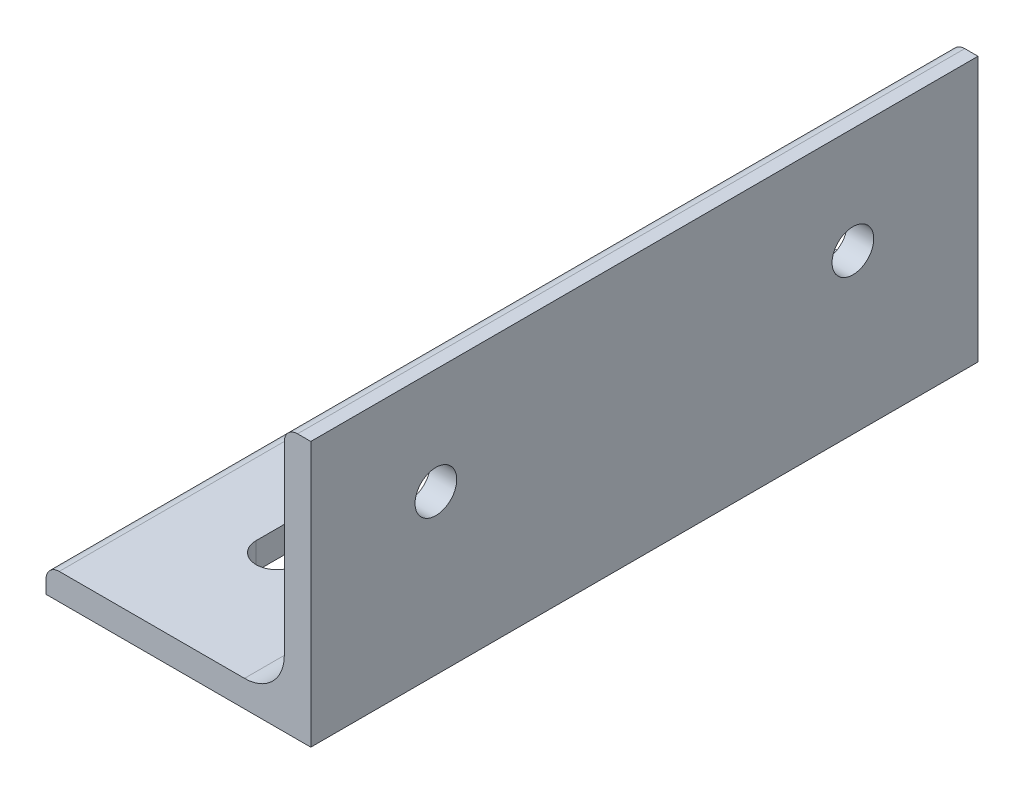
from build123d import *

# Parameters (mm, degrees)
BOSS_EXTRUDE1_DEPTH = 304.8
SKETCH3_W           = 34.414454966
SKETCH3_H           = 33.657940314
CUT_EXTRUDE1_DEPTH  = 529.6
SKETCH5_R           = 2.5
CUT_EXTRUDE2_DEPTH  = 101.6
CUT_EXTRUDE3_DEPTH  = 101.6


with BuildPart() as part:
    # Sketch2 → Boss-Extrude1 (new, symmetric)
    with BuildSketch(Plane.XY):
        with BuildLine():
            Line((-15.875, -15.875), (15.875, -15.875))
            Line((15.875, -15.875), (15.875, 15.875))
            Line((15.875, 15.875), (14.2875, 15.875))
            ThreePointArc((14.2875, 15.875), (13.164967985, 15.410032015), (12.7, 14.2875))
            Line((12.7, 14.2875), (12.7, -7.9248))
            ThreePointArc((12.7, -7.9248), (11.301376302, -11.301376302), (7.9248, -12.7))
            Line((7.9248, -12.7), (-14.2875, -12.7))
            ThreePointArc((-14.2875, -12.7), (-15.410032015, -13.164967985), (-15.875, -14.2875))
            Line((-15.875, -14.2875), (-15.875, -15.875))
        make_face()
    extrude(amount=BOSS_EXTRUDE1_DEPTH, both=True)

    # Sketch3 → Cut-Extrude1 (cut)
    with BuildSketch(Plane(origin=(0, 0, -304.8), x_dir=(-1, 0, 0), z_dir=(0, 0, -1))):
        with Locations((1.332227483, 0.953970157)):
            Rectangle(SKETCH3_W, SKETCH3_H)
    extrude(amount=-CUT_EXTRUDE1_DEPTH, mode=Mode.SUBTRACT)

    # Sketch5 → Cut-Extrude2 (cut)
    with BuildSketch(Plane.ZY.offset(-12.7)):
        with Locations(Location((289.8, 3.18135, 0), (0, 0, 270))):
            Circle(SKETCH5_R)
        with Locations(Location((239.8, 3.18135, 0), (0, 0, 270))):
            Circle(SKETCH5_R)
    extrude(amount=-CUT_EXTRUDE2_DEPTH, mode=Mode.SUBTRACT)

    # Sketch4 → Cut-Extrude3 (cut)
    with BuildSketch(Plane(origin=(0, -12.7, 0), x_dir=(1, 0, 0), z_dir=(0, 1, 0))):
        with BuildLine():
            Line((-0.68135, -239.8), (-0.68135, -289.8))
            ThreePointArc((-0.68135, -289.8), (-3.18135, -292.3), (-5.68135, -289.8))
            Line((-5.68135, -289.8), (-5.68135, -239.8))
            ThreePointArc((-5.68135, -239.8), (-3.18135, -237.3), (-0.68135, -239.8))
        make_face()
    extrude(amount=-CUT_EXTRUDE3_DEPTH, mode=Mode.SUBTRACT)


solid = part.part
